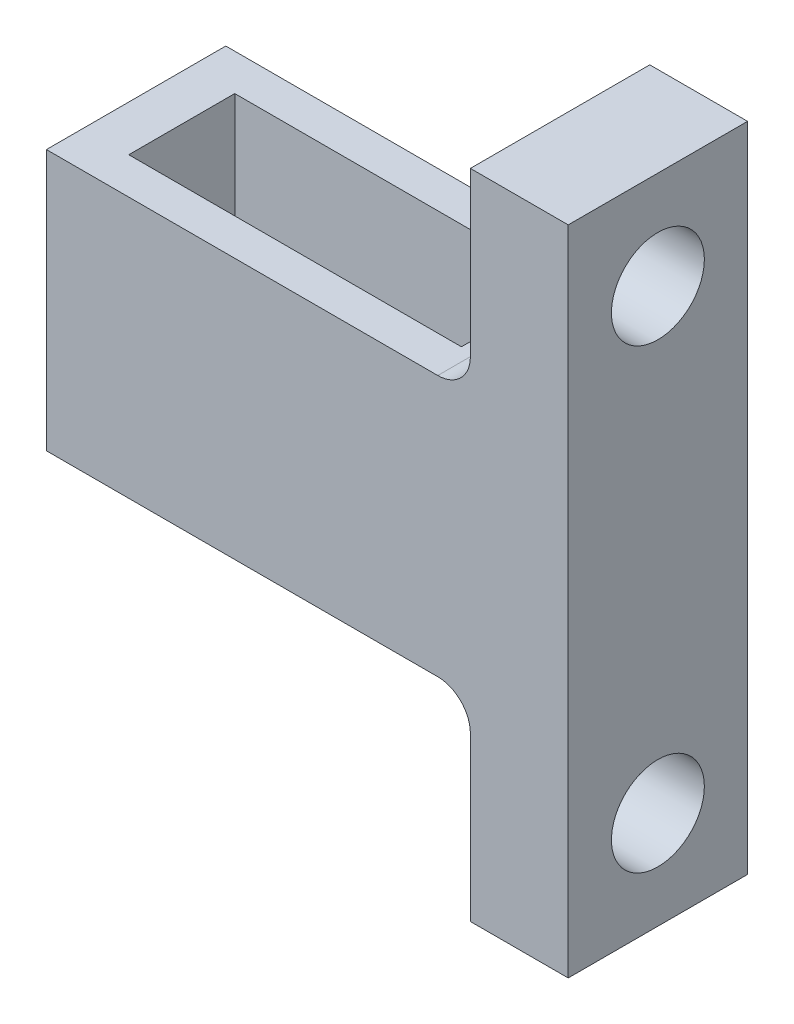
from build123d import *

# Parameters (mm, degrees)
SKETCH2_W           = 26
SKETCH2_H           = 11
SKETCH2_W_2         = 20.4
SKETCH2_H_2         = 6.5
BOSS_EXTRUDE1_DEPTH = 10
SKETCH3_W           = 26
SKETCH3_H           = 11
SKETCH3_W_2         = 2.5
SKETCH3_H_2         = 6.5
BOSS_EXTRUDE2_DEPTH = 6
SKETCH4_W           = 11
SKETCH4_H           = 40
SKETCH4_R           = 2.85
BOSS_EXTRUDE3_DEPTH = 6
FILLET1_R           = 2


with BuildPart() as part:
    # Sketch2 → Boss-Extrude1 (new body)
    with BuildSketch(Plane(origin=(0, 0, 0), x_dir=(1, 0, 0), z_dir=(0, 1, 0))):
        Rectangle(SKETCH2_W, SKETCH2_H)
        Rectangle(SKETCH2_W_2, SKETCH2_H_2, mode=Mode.SUBTRACT)
    extrude(amount=BOSS_EXTRUDE1_DEPTH)

    # Sketch3 → Boss-Extrude2 (add)
    with BuildSketch(Plane.XZ):
        Rectangle(SKETCH3_W, SKETCH3_H)
        with Locations((-7.45, 0)):
            Rectangle(SKETCH3_W_2, SKETCH3_H_2, mode=Mode.SUBTRACT)
        with Locations((-0.25, 0)):
            Rectangle(SKETCH3_W_2, SKETCH3_H_2, mode=Mode.SUBTRACT)
        with Locations((7.45, 0)):
            Rectangle(SKETCH3_W_2, SKETCH3_H_2, mode=Mode.SUBTRACT)
    extrude(amount=BOSS_EXTRUDE2_DEPTH)

    # Sketch4 → Boss-Extrude3 (add)
    with BuildSketch(Plane(origin=(13, 0, 0), x_dir=(0, 0, -1), z_dir=(1, 0, 0))):
        with Locations((0, 2)):
            Rectangle(SKETCH4_W, SKETCH4_H)
        with Locations((0, 16)):
            Circle(SKETCH4_R, mode=Mode.SUBTRACT)
        with Locations((0, -11.995757917)):
            Circle(SKETCH4_R, mode=Mode.SUBTRACT)
    extrude(amount=BOSS_EXTRUDE3_DEPTH)

    # Fillet1
    fillet1_edges = [part.edges().sort_by_distance(p)[0] for p in [
        (13, -6, 0),
        (13, 10, 0),
    ]]
    fillet(fillet1_edges, radius=FILLET1_R)


solid = part.part
